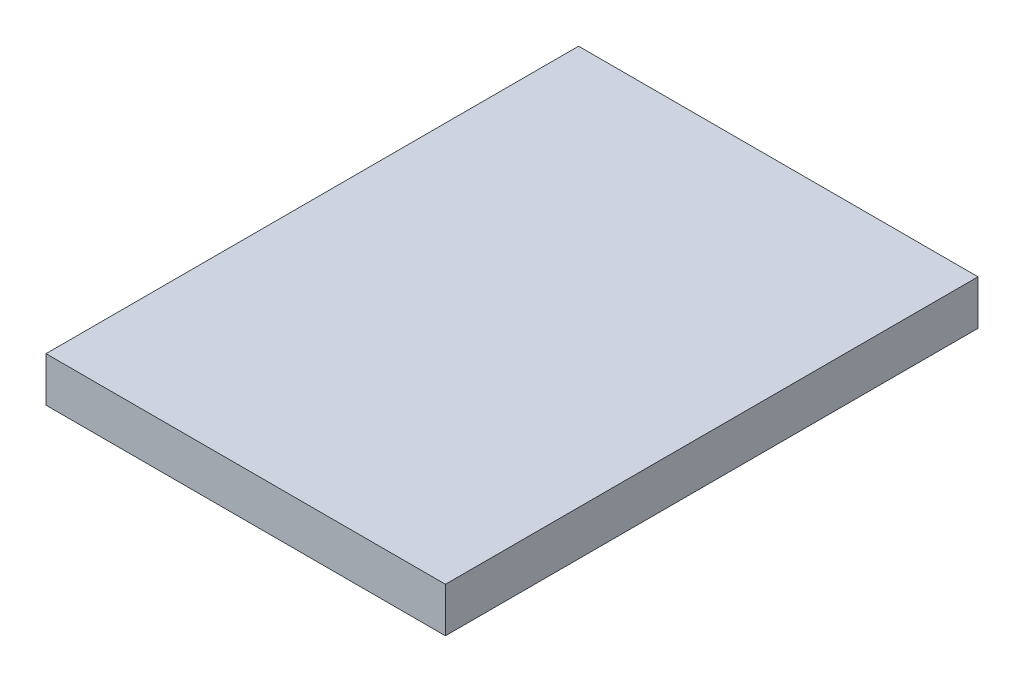
from build123d import *

# Parameters (mm, degrees)
SKETCH1_W           = 51
SKETCH1_H           = 68
BOSS_EXTRUDE1_DEPTH = 5.7


with BuildPart() as part:
    # Sketch1 → Boss-Extrude1 (new body)
    with BuildSketch(Plane(origin=(0, 0, 0), x_dir=(1, 0, 0), z_dir=(0, 1, 0))):
        with Locations((25.5, 34)):
            Rectangle(SKETCH1_W, SKETCH1_H)
    extrude(amount=BOSS_EXTRUDE1_DEPTH)


solid = part.part
